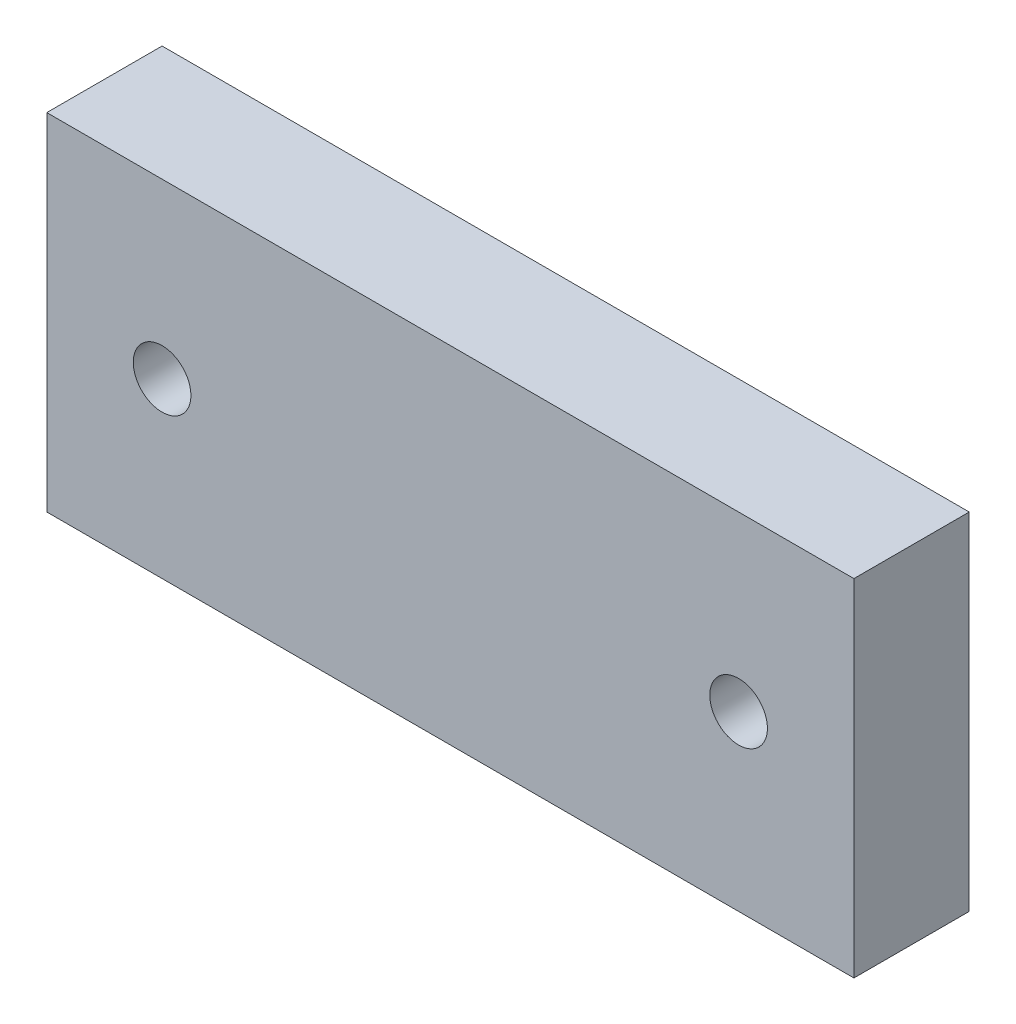
from build123d import *

# Parameters (mm, degrees)
CROQUIS1_W              = 28
CROQUIS1_H              = 12
SALIENTE_EXTRUIR1_DEPTH = 4
CROQUIS2_R              = 1
CORTAR_EXTRUIR1_DEPTH   = 4


with BuildPart() as part:
    # Croquis1 → Saliente-Extruir1 (new body)
    with BuildSketch(Plane.XY):
        with Locations((-16.412225504, 7.356643357)):
            Rectangle(CROQUIS1_W, CROQUIS1_H)
    extrude(amount=SALIENTE_EXTRUIR1_DEPTH)

    # Croquis2 → Cortar-Extruir1 (cut)
    with BuildSketch(Plane.XY.offset(4)):
        with Locations((-26.412225504, 7.356643357)):
            Circle(CROQUIS2_R)
        with Locations((-6.412225504, 7.356643357)):
            Circle(CROQUIS2_R)
    extrude(amount=-CORTAR_EXTRUIR1_DEPTH, mode=Mode.SUBTRACT)


solid = part.part
